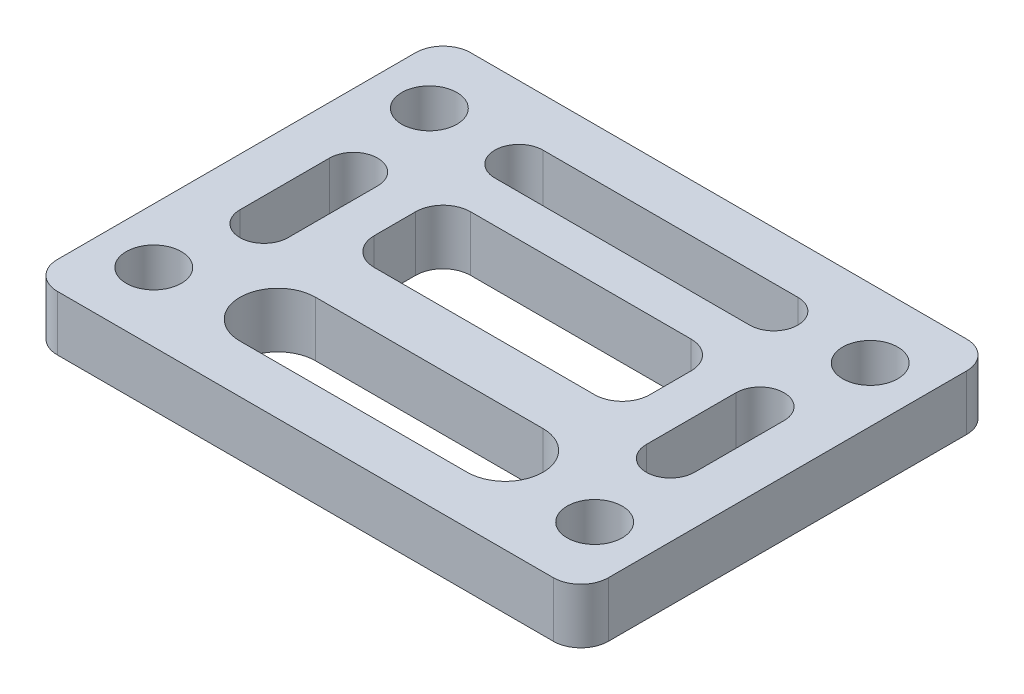
from build123d import *

# Parameters (mm, degrees)
SKETCH_1_W          = 40
SKETCH_1_H          = 30
SKETCH_1_R          = 2
SKETCH_1_W_2        = 20
SKETCH_1_H_2        = 7
EXTRUDE_1_DEPTH     = 4
CUT_EXTRUDE_1_DEPTH = 26.317977802
FILLET_1_R          = 2


with BuildPart() as part:
    # 草图1 → 凸台-拉伸1 (new body)
    with BuildSketch(Plane(origin=(0, 0, 0), x_dir=(1, 0, 0), z_dir=(0, 1, 0))):
        Rectangle(SKETCH_1_W, SKETCH_1_H)
        with Locations(Location((-16, 10, 0), (0, 0, 270))):
            Circle(SKETCH_1_R, mode=Mode.SUBTRACT)
        with Locations(Location((-16, -10, 0), (0, 0, 270))):
            Circle(SKETCH_1_R, mode=Mode.SUBTRACT)
        with Locations(Location((16, 10, 0), (0, 0, 270))):
            Circle(SKETCH_1_R, mode=Mode.SUBTRACT)
        with Locations(Location((16, -10, 0), (0, 0, 270))):
            Circle(SKETCH_1_R, mode=Mode.SUBTRACT)
        with Locations((0, 1.5)):
            Rectangle(SKETCH_1_W_2, SKETCH_1_H_2, mode=Mode.SUBTRACT)
    extrude(amount=EXTRUDE_1_DEPTH)

    # 草图2 → 切除-拉伸1 (cut, through all)
    with BuildSketch(Plane(origin=(0, 4, 0), x_dir=(1, 0, 0), z_dir=(0, 1, 0))):
        with BuildLine():
            Line((-9.25, 11.5), (9.25, 11.5))
            ThreePointArc((9.25, 11.5), (11, 9.75), (9.25, 8))
            Line((9.25, 8), (-9.25, 8))
            ThreePointArc((-9.25, 8), (-11, 9.75), (-9.25, 11.5))
        make_face()
        with BuildLine():
            Line((-13, 3.25), (-13, -3.25))
            ThreePointArc((-13, -3.25), (-14.75, -5), (-16.5, -3.25))
            Line((-16.5, -3.25), (-16.5, 3.25))
            ThreePointArc((-16.5, 3.25), (-14.75, 5), (-13, 3.25))
        make_face()
        with BuildLine():
            Line((13, 3.25), (13, -3.25))
            ThreePointArc((13, -3.25), (14.75, -5), (16.5, -3.25))
            Line((16.5, -3.25), (16.5, 3.25))
            ThreePointArc((16.5, 3.25), (14.75, 5), (13, 3.25))
        make_face()
        with BuildLine():
            Line((-8.25, -11.5), (8.25, -11.5))
            ThreePointArc((8.25, -11.5), (11, -8.75), (8.25, -6))
            Line((8.25, -6), (-8.25, -6))
            ThreePointArc((-8.25, -6), (-11, -8.75), (-8.25, -11.5))
        make_face()
    extrude(amount=-CUT_EXTRUDE_1_DEPTH, mode=Mode.SUBTRACT)

    # 圆角1
    fillet_1_edges = [part.edges().sort_by_distance(p)[0] for p in [
        (-10, 2, -5),
        (-10, 2, 2),
        (10, 2, 2),
        (10, 2, -5),
        (-20, 2, -15),
        (20, 2, -15),
        (20, 2, 15),
        (-20, 2, 15),
    ]]
    fillet(fillet_1_edges, radius=FILLET_1_R)


solid = part.part
